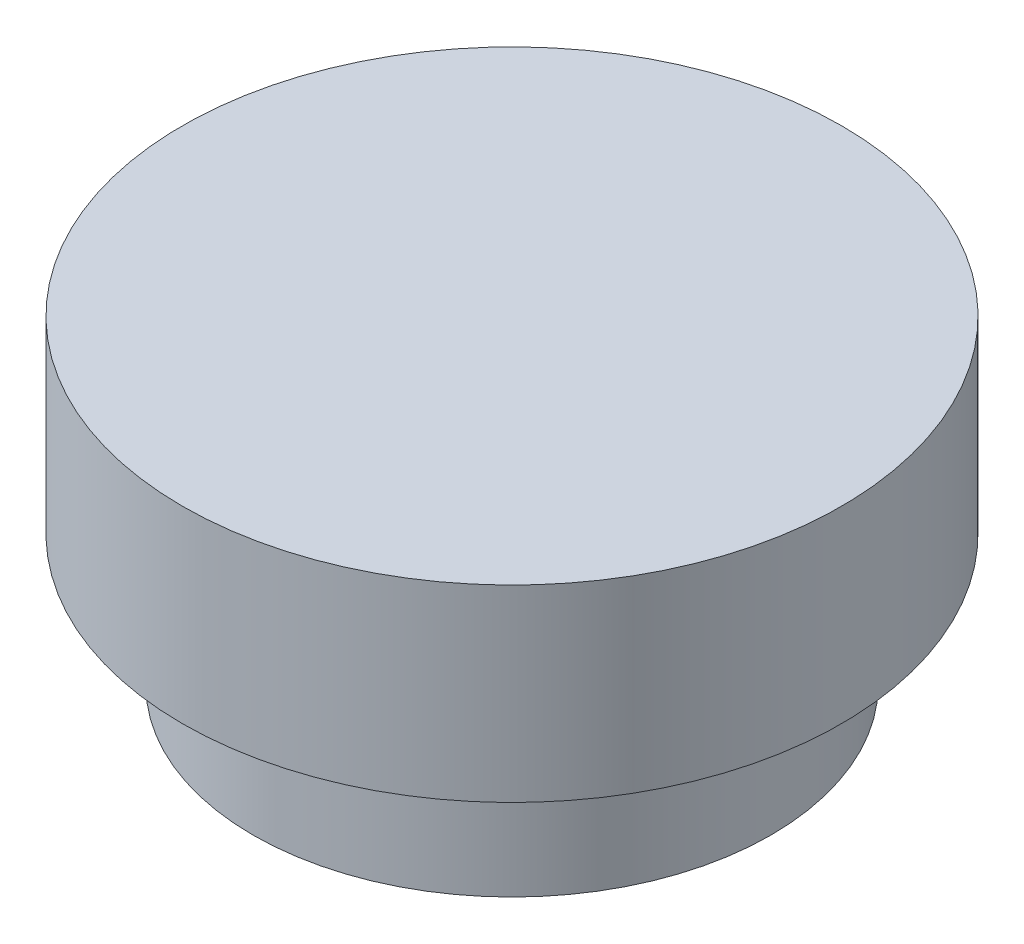
from build123d import *

# Parameters (mm, degrees)
SKETCH1_R           = 5
BOSS_EXTRUDE1_DEPTH = 10
SKETCH2_R           = 27.5
BOSS_EXTRUDE2_DEPTH = 14
SKETCH3_R           = 35
BOSS_EXTRUDE3_DEPTH = 20


with BuildPart() as part:
    # Sketch1 → Boss-Extrude1 (new body)
    with BuildSketch(Plane(origin=(0, 0, 0), x_dir=(1, 0, 0), z_dir=(0, 1, 0))):
        with Locations(Location((0, 0, 0), (0, 0, 270))):
            Circle(SKETCH1_R)
    extrude(amount=BOSS_EXTRUDE1_DEPTH)

    # Sketch2 → Boss-Extrude2 (add)
    with BuildSketch(Plane(origin=(0, 10, 0), x_dir=(1, 0, 0), z_dir=(0, 1, 0))):
        with Locations(Location((0, 0, 0), (0, 0, 270))):
            Circle(SKETCH2_R)
    extrude(amount=BOSS_EXTRUDE2_DEPTH)

    # Sketch3 → Boss-Extrude3 (add)
    with BuildSketch(Plane(origin=(0, 24, 0), x_dir=(1, 0, 0), z_dir=(0, 1, 0))):
        with Locations(Location((0, 0, 0), (0, 0, 270))):
            Circle(SKETCH3_R)
    extrude(amount=BOSS_EXTRUDE3_DEPTH)


solid = part.part
